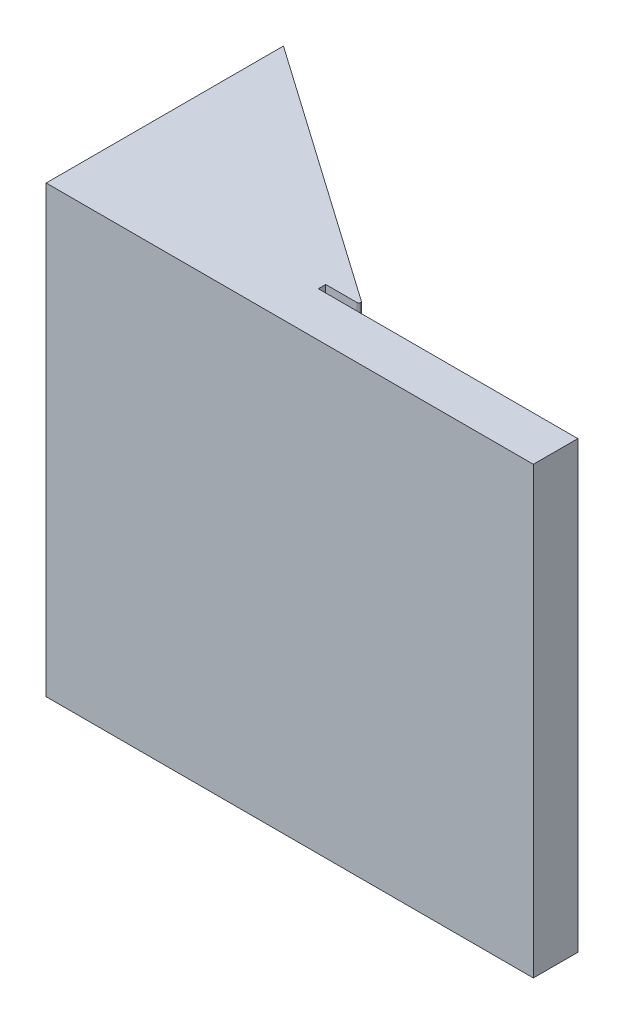
from build123d import *

# Parameters (mm, degrees)
BOSS_EXTRUDE1_DEPTH = 60
FILLET1_R           = 0.25


with BuildPart() as part:
    # Sketch1 → Boss-Extrude1 (new body)
    with BuildSketch(Plane(origin=(0, 0, 0), x_dir=(1, 0, 0), z_dir=(0, 1, 0))):
        Polygon((15, -3), (-15, -3), (-50.703700169, -3), (-50.703700169, 29), (-15, 4), (-20, 4), (-20, 3), (-15, 3), (15, 3), align=None)
    extrude(amount=BOSS_EXTRUDE1_DEPTH)

    # Fillet1
    fillet1_edges = [part.edges().sort_by_distance(p)[0] for p in [
        (-15, 30, -4),
    ]]
    fillet(fillet1_edges, radius=FILLET1_R)


solid = part.part
